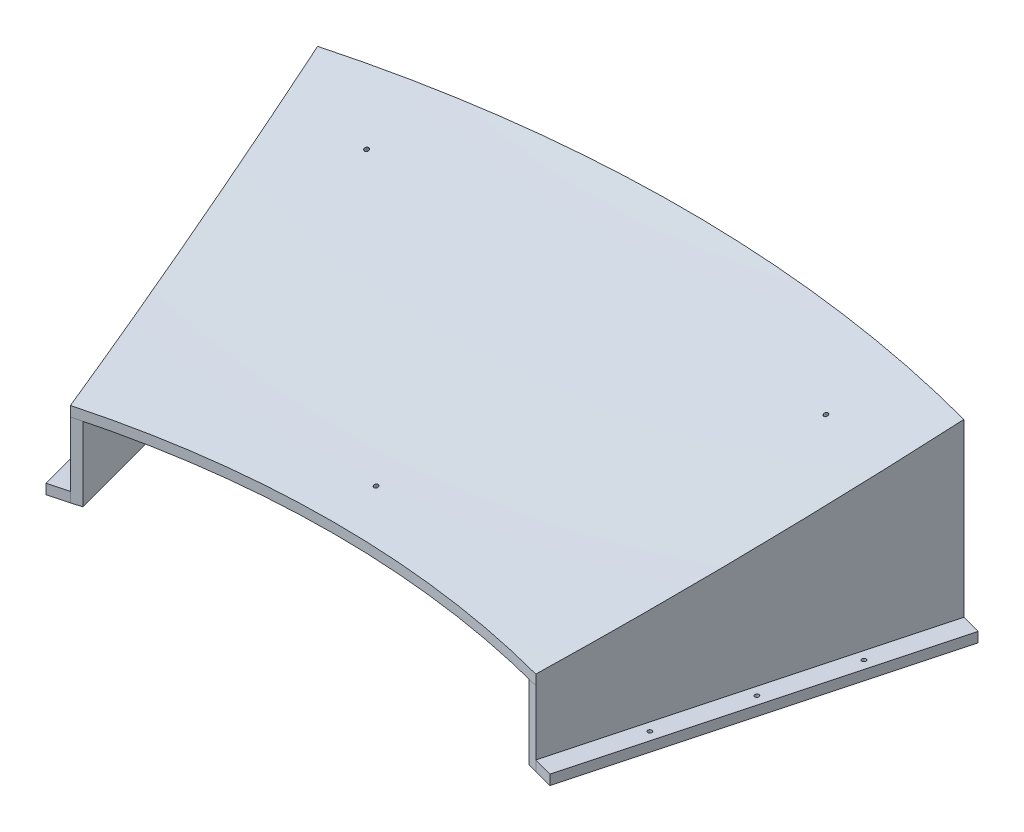
from build123d import *

# Parameters (mm, degrees)
REVOLVE_1_ANGLE             = 15
REVOLVE_1_OTHER_WAY_ANGLE   = 15
EXTRUDE_1_REACH             = 1305.891
SKETCH_6_W                  = 350.000000001
SKETCH_6_H                  = 10
EXTRUDE_2_DEPTH             = 20
SKETCH_7_W                  = 350.000000001
SKETCH_7_H                  = 10
EXTRUDE_3_DEPTH             = 20
HOLE_WIZARD_M51_D           = 4.2
HOLE_WIZARD_M51_ON_FACE_2_D = 4.2
HOLE_WIZARD_M51_ON_FACE_3_D = 4.2
HOLE_WIZARD_M52_D           = 4.2


with BuildPart() as part:
    # Эскиз2 → Повернуть1 (revolve)
    with BuildSketch(Plane(origin=(0, 0, 0), x_dir=(0, 0, -1), z_dir=(1, 0, 0))):
        with BuildLine():
            Line((1250.000000001, 181.562500008), (1250.000000001, 171.562500008))
            add(Edge.make_bspline(
                [(900, 74.490000004), (1075.000000001, 115.125000006), (1250.000000001, 171.562500008)],
                knots=[0.083425123, 0.083425123, 0.083425123, 0.917676354, 0.917676354, 0.917676354], degree=2))
            Line((900, 74.490000004), (900, 84.490000004))
            add(Edge.make_bspline(
                [(900, 84.490000004), (1075.000000001, 125.125000006), (1250.000000001, 181.562500008)],
                knots=[0.083425123, 0.083425123, 0.083425123, 0.917676354, 0.917676354, 0.917676354], degree=2))
        make_face()
    revolve(axis=Axis((0, 605.286784652, 0), (0, -1, 0)), revolution_arc=REVOLVE_1_ANGLE)

    # Эскиз2 → Повернуть1 other way (revolve)
    with BuildSketch(Plane(origin=(0, 0, 0), x_dir=(0, 0, -1), z_dir=(1, 0, 0))):
        with BuildLine():
            Line((1250.000000001, 181.562500008), (1250.000000001, 171.562500008))
            add(Edge.make_bspline(
                [(900, 74.490000004), (1075.000000001, 115.125000006), (1250.000000001, 171.562500008)],
                knots=[0.083425123, 0.083425123, 0.083425123, 0.917676354, 0.917676354, 0.917676354], degree=2))
            Line((900, 74.490000004), (900, 84.490000004))
            add(Edge.make_bspline(
                [(900, 84.490000004), (1075.000000001, 125.125000006), (1250.000000001, 181.562500008)],
                knots=[0.083425123, 0.083425123, 0.083425123, 0.917676354, 0.917676354, 0.917676354], degree=2))
        make_face()
    revolve(axis=Axis((0, 605.286784652, 0), (0, 1, 0)), revolution_arc=REVOLVE_1_OTHER_WAY_ANGLE)

    # Эскиз5 → Бобышка-Вытянуть1 (add, up to next)
    with BuildSketch(Plane(origin=(0, 0, 0), x_dir=(1, 0, 0), z_dir=(0, 1, 0)), mode=Mode.PRIVATE) as extrude_1_sk1:
        Polygon((-323.523806378, 1207.407282862), (-232.937140592, 869.33324366), (-223.323059362, 872.090037092), (-313.819371083, 1209.826870333), align=None)
    extrude_1_tool1 = extrude(extrude_1_sk1.sketch, amount=EXTRUDE_1_REACH, mode=Mode.PRIVATE) - part.part
    # Эскиз5 → Бобышка-Вытянуть1 (add, up to next)
    with BuildSketch(Plane(origin=(0, 0, 0), x_dir=(1, 0, 0), z_dir=(0, 1, 0)), mode=Mode.PRIVATE) as extrude_1_sk2:
        Polygon((323.523806378, 1207.407282862), (232.937140592, 869.33324366), (223.323059362, 872.090037092), (313.819371083, 1209.826870333), align=None)
    extrude_1_tool2 = extrude(extrude_1_sk2.sketch, amount=EXTRUDE_1_REACH, mode=Mode.PRIVATE) - part.part
    add(extrude_1_tool1.solids().sort_by_distance((-273.401648, 0, -1039.664143))[0])
    add(extrude_1_tool2.solids().sort_by_distance((273.401648, 0, -1039.664143))[0])

    # Эскиз6 → Бобышка-Вытянуть2 (add)
    with BuildSketch(Plane(origin=(0, 0, 0), x_dir=(0.25881904510252135, 0, 0.9659258262890682), z_dir=(-0.9659258262890681, 0, 0.2588190451025213))):
        with Locations((-1075, 5)):
            Rectangle(SKETCH_6_W, SKETCH_6_H)
    extrude(amount=EXTRUDE_2_DEPTH)

    # Эскиз7 → Бобышка-Вытянуть3 (add)
    with BuildSketch(Plane(origin=(0, 0, 0), x_dir=(0.25881904510252124, 0, -0.9659258262890682), z_dir=(0.9659258262890682, 0, 0.25881904510252124))):
        with Locations((1075, 5)):
            Rectangle(SKETCH_7_W, SKETCH_7_H)
    extrude(amount=EXTRUDE_3_DEPTH)

    # Отверстие обработанное метчиком M51 (through all)
    with Locations(Plane(origin=(229.986727308, 161.264444267, -1162.865785876), x_dir=(0, -0.28736490905, 0.957821178011), z_dir=(-0.056742261531, 0.956277993991, 0.286901923948))):
        with Locations((0, 0)):
            Hole(HOLE_WIZARD_M51_D / 2)

    # Отверстие обработанное метчиком M51 on face 2 (through all)
    with Locations(Plane(origin=(-229.986727308, 161.264444267, -1162.865785876), x_dir=(0, -0.287364977278, 0.957821157542), z_dir=(0.056741999278, 0.95627798783, 0.286901996349))):
        with Locations((0, 0)):
            Hole(HOLE_WIZARD_M51_ON_FACE_2_D / 2)

    # Отверстие обработанное метчиком M51 on face 3 (through all)
    with Locations(Plane(origin=(0, 94.55738613, -942.359672798), x_dir=(0, -0.23624700812, 0.971693033398), z_dir=(0, 0.971693033398, 0.23624700812))):
        with Locations((-1e-09, 0)):
            Hole(HOLE_WIZARD_M51_ON_FACE_3_D / 2)

    # Отверстие обработанное метчиком M52 (through all)
    with Locations(Plane(origin=(0, 10, 0), x_dir=(1, 0, 0), z_dir=(0, 1, 0))):
        with Locations((-310.536398195, 1120.300582611), (-287.889731748, 1035.782072811), (-265.243065302, 951.26356301), (310.536398196, 1120.300582611), (287.889731751, 1035.78207281), (265.243065306, 951.263563009)):
            Hole(HOLE_WIZARD_M52_D / 2)


solid = part.part
